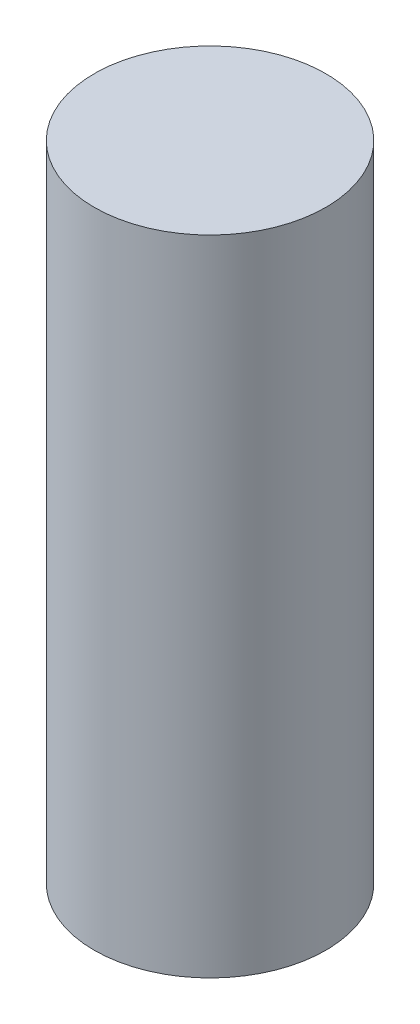
from build123d import *

# Parameters (mm, degrees)
SKETCH1_R           = 1.8
BOSS_EXTRUDE1_DEPTH = 10


with BuildPart() as part:
    # Sketch1 → Boss-Extrude1 (new body)
    with BuildSketch(Plane(origin=(0, 0, 0), x_dir=(1, 0, 0), z_dir=(0, 1, 0))):
        with Locations(Location((0, 0, 0), (0, 0, 270))):
            Circle(SKETCH1_R)
    extrude(amount=BOSS_EXTRUDE1_DEPTH)


solid = part.part
